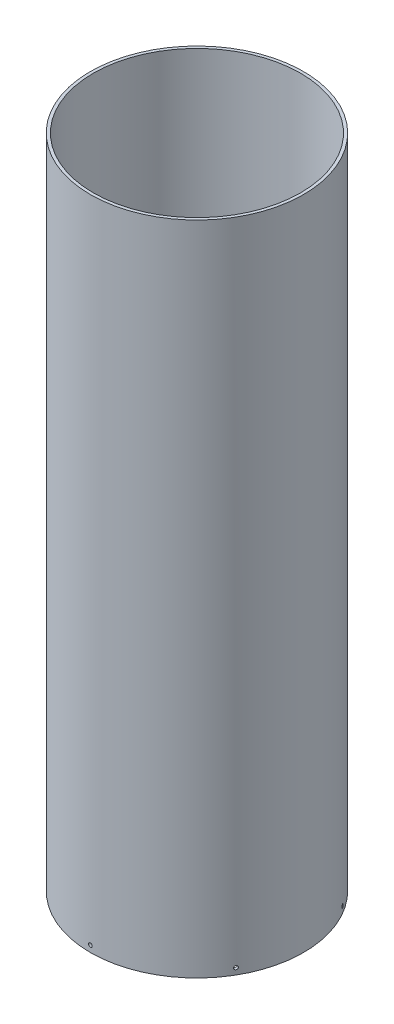
from build123d import *

# Parameters (mm, degrees)
SKETCH1_R           = 78.359
SKETCH1_R_2         = 76.2
BOSS_EXTRUDE1_DEPTH = 482.6
SKETCH2_R           = 1.35255
CUT_EXTRUDE1_DEPTH  = 496.159596254
CIRPATTERN1_COUNT   = 6


with BuildPart() as part:
    # Sketch1 → Boss-Extrude1 (new body)
    with BuildSketch(Plane(origin=(0, 0, 0), x_dir=(1, 0, 0), z_dir=(0, 1, 0))):
        with Locations(Location((0, 0, 0), (0, 0, 90))):
            Circle(SKETCH1_R)
        with Locations(Location((0, 0, 0), (0, 0, 90))):
            Circle(SKETCH1_R_2, mode=Mode.SUBTRACT)
    extrude(amount=BOSS_EXTRUDE1_DEPTH)

    # Sketch2 → Cut-Extrude1 (cut, through all)
    with BuildSketch(Plane.XY):
        with Locations(Location((0, 4.7625, 0), (0, 0, 90))):
            Circle(SKETCH2_R)
    cut_extrude1 = extrude(amount=-CUT_EXTRUDE1_DEPTH, mode=Mode.SUBTRACT)

    # CirPattern1: Cut-Extrude1 ×6 about axis
    cirpattern1_axis = Axis((0, 482.6, 0), (0, -1, 0))
    for i in range(1, CIRPATTERN1_COUNT):
        add(cut_extrude1.rotate(cirpattern1_axis, i * 360 / CIRPATTERN1_COUNT), mode=Mode.SUBTRACT)


solid = part.part
